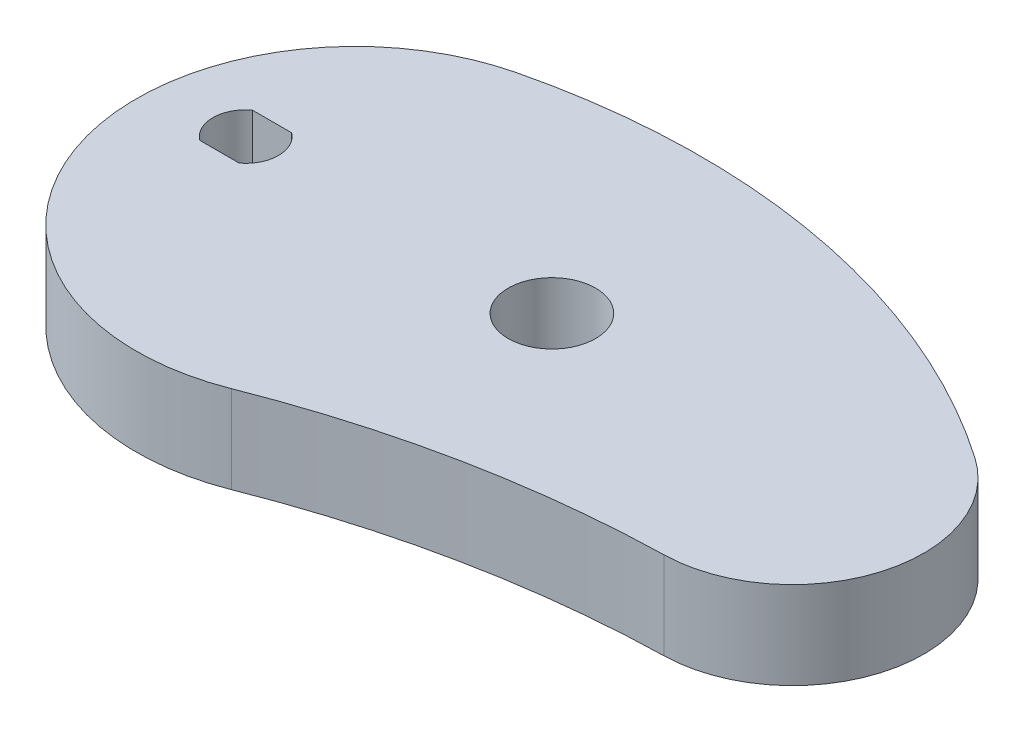
from build123d import *

# Parameters (mm, degrees)
SKETCH1_R      = 12.7
EXTRUDE1_DEPTH = 25.4


with BuildPart() as part:
    # Sketch1 → Extrude1 (new body)
    with BuildSketch(Plane(origin=(0, 0, 0), x_dir=(1, 0, 0), z_dir=(0, 1, 0))):
        with BuildLine():
            ThreePointArc((-15.009090909, 61.700706561), (-60.542428713, -19.15370266), (23.210344828, -59.106090151))
            ThreePointArc((23.210344828, -59.106090151), (74.601523764, -43.982890719), (127.846666667, -38.090591431))
            ThreePointArc((127.846666667, -38.090591431), (163.49081416, -10.955842364), (148.687692308, 31.3249741))
            ThreePointArc((148.687692308, 31.3249741), (70.093122075, 64.047893785), (-15.009090909, 61.700706561))
        make_face()
        with Locations(Location((50.8, 6.35, 0), (0, 0, 270))):
            Circle(SKETCH1_R, mode=Mode.SUBTRACT)
        with BuildLine():
            Line((-43.815, 13.97), (-32.385, 13.97))
            ThreePointArc((-32.385, 13.97), (-28.575, 6.35), (-32.385, -1.27))
            Line((-32.385, -1.27), (-43.815, -1.27))
            ThreePointArc((-43.815, -1.27), (-47.625, 6.35), (-43.815, 13.97))
        make_face(mode=Mode.SUBTRACT)
    extrude(amount=EXTRUDE1_DEPTH)


solid = part.part
